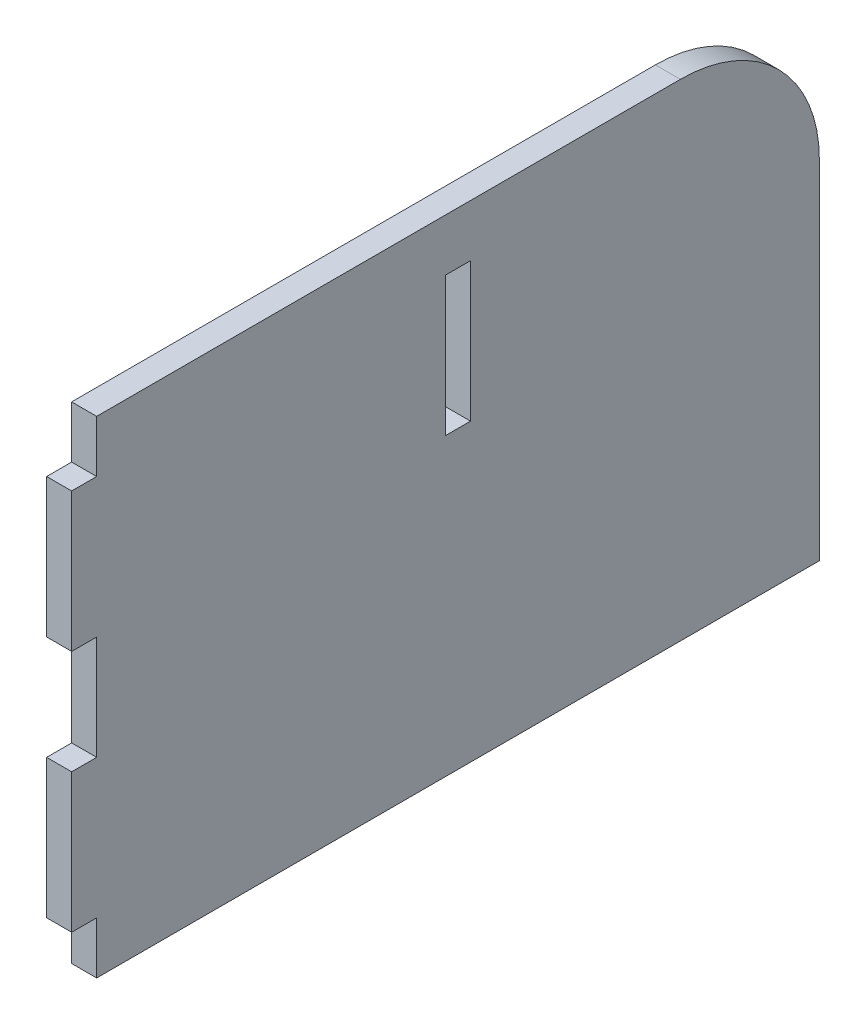
from build123d import *

# Parameters (mm, degrees)
SKETCH1_W           = 18
SKETCH1_H           = 100
BOSS_EXTRUDE3_DEPTH = 18


with BuildPart() as part:
    # Sketch1 → Boss-Extrude3 (new body)
    with BuildSketch(Plane(origin=(0, 0, 0), x_dir=(0, 0, -1), z_dir=(1, 0, 0))):
        with BuildLine():
            Line((0, 0), (420, 0))
            ThreePointArc((420, 0), (490.710678119, -29.289321881), (520, -100))
            Line((520, -100), (520, -350))
            Line((520, -350), (0, -350))
            Line((0, -350), (0, -312.5))
            Line((0, -312.5), (-18, -312.5))
            Line((-18, -312.5), (-18, -212.5))
            Line((-18, -212.5), (0, -212.5))
            Line((0, -212.5), (0, -137.5))
            Line((0, -137.5), (-18, -137.5))
            Line((-18, -137.5), (-18, -37.5))
            Line((-18, -37.5), (0, -37.5))
            Line((0, -37.5), (0, 0))
        make_face()
        with Locations((260, -87.5)):
            Rectangle(SKETCH1_W, SKETCH1_H, mode=Mode.SUBTRACT)
    extrude(amount=BOSS_EXTRUDE3_DEPTH)


solid = part.part
